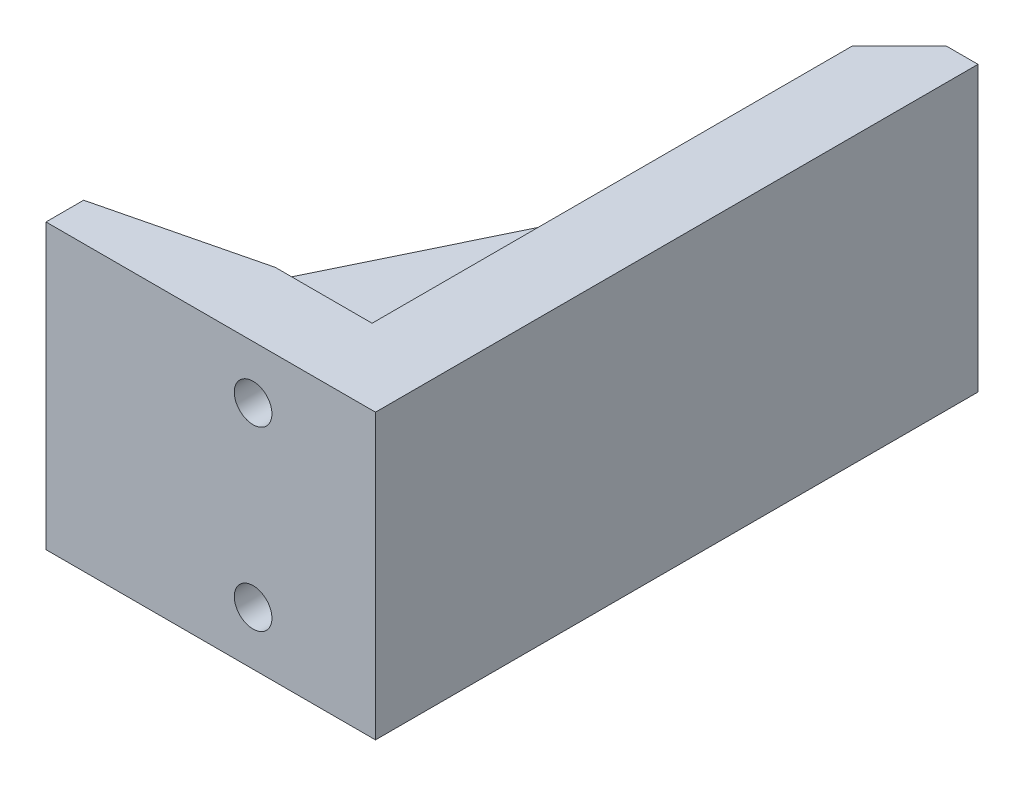
from build123d import *

# Parameters (mm, degrees)
SKETCH1_W           = 17.145
SKETCH1_H           = 17.145
BOSS_EXTRUDE1_DEPTH = 5.08
SKETCH2_R           = 1.27
CUT_EXTRUDE1_DEPTH  = 25.773139688
SKETCH3_R           = 2.54
CUT_EXTRUDE4_DEPTH  = 2.54
SKETCH4_W           = 6.307704678
SKETCH4_H           = 17.145
BOSS_EXTRUDE2_DEPTH = 17.78
SKETCH5_W           = 2.54
SKETCH5_H           = 17.145
BOSS_EXTRUDE3_DEPTH = 5.08
CHAMFER1_SIZE       = 3.175
BOSS_EXTRUDE4_DEPTH = 2.54
BOSS_EXTRUDE5_DEPTH = 2.54
SKETCH9_W           = 1
SKETCH9_H           = 17.145
CUT_EXTRUDE5_DEPTH  = 17.78
EXTRUDE_1_DEPTH     = 1
EXTRUDE_2_DEPTH     = 1
EXTRUDE_3_DEPTH     = 5.31
CUT_EXTRUDE_1_DEPTH = 44.874772364
CUT_EXTRUDE_2_DEPTH = 44.874772364
EXTRUDE_4_DEPTH     = 2.655
EXTRUDE_5_DEPTH     = 6.915
EXTRUDE_6_DEPTH     = 6.92


with BuildPart() as part:
    # Sketch1 → Boss-Extrude1 (new body)
    with BuildSketch(Plane.XY):
        with Locations((8.5725, -8.5725)):
            Rectangle(SKETCH1_W, SKETCH1_H)
    extrude(amount=BOSS_EXTRUDE1_DEPTH)

    # Sketch2 → Cut-Extrude1 (cut, through all)
    with BuildSketch(Plane(origin=(0, 0, 0), x_dir=(-1, 0, 0), z_dir=(0, 0, -1))):
        with Locations((-8.89, -2.5908)):
            Circle(SKETCH2_R)
        with Locations((-8.89, -14.5288)):
            Circle(SKETCH2_R)
    extrude(amount=-CUT_EXTRUDE1_DEPTH, mode=Mode.SUBTRACT)

    # Sketch3 → Cut-Extrude4 (cut)
    with BuildSketch(Plane(origin=(0, 0, 0), x_dir=(-1, 0, 0), z_dir=(0, 0, -1))):
        with Locations((-8.89, -2.5908)):
            Circle(SKETCH3_R)
        with Locations((-8.89, -14.5288)):
            Circle(SKETCH3_R)
    extrude(amount=-CUT_EXTRUDE4_DEPTH, mode=Mode.SUBTRACT)

    # Sketch4 → Boss-Extrude2 (add)
    with BuildSketch(Plane(origin=(0, 0, 0), x_dir=(-1, 0, 0), z_dir=(0, 0, -1))):
        with Locations((-3.153852339, -8.5725)):
            Rectangle(SKETCH4_W, SKETCH4_H)
    extrude(amount=BOSS_EXTRUDE2_DEPTH)

    # Sketch5 → Boss-Extrude3 (add)
    with BuildSketch(Plane.ZY):
        with Locations((3.81, -8.5725)):
            Rectangle(SKETCH5_W, SKETCH5_H)
    extrude(amount=BOSS_EXTRUDE3_DEPTH)

    # Chamfer1
    chamfer1_edges = [part.edges().sort_by_distance(p)[0] for p in [
        (0, -8.5725, -17.78),
    ]]
    chamfer(chamfer1_edges, length=CHAMFER1_SIZE)

    # Sketch7 → Boss-Extrude4 (add)
    with BuildSketch(Plane(origin=(0, 0, 0), x_dir=(1, 0, 0), z_dir=(0, 1, 0))):
        Polygon((-5.08, -2.54), (0, 14.605), (0, -2.54), align=None)
    extrude(amount=-BOSS_EXTRUDE4_DEPTH)

    # Sketch8 → Boss-Extrude5 (add)
    with BuildSketch(Plane.XZ.offset(17.145)):
        Polygon((0, 2.54), (-5.08, 2.54), (0, -14.605), align=None)
    extrude(amount=-BOSS_EXTRUDE5_DEPTH)

    # Sketch9 → Cut-Extrude5 (cut)
    with BuildSketch(Plane(origin=(0, 0, -17.78), x_dir=(-1, 0, 0), z_dir=(0, 0, -1))):
        with Locations((-5.807704678, -8.5725)):
            Rectangle(SKETCH9_W, SKETCH9_H)
    extrude(amount=-CUT_EXTRUDE5_DEPTH, mode=Mode.SUBTRACT)

    # 草图1 → 凸台-拉伸1 (add)
    with BuildSketch(Plane(origin=(0, 0, 0), x_dir=(1, 0, 0), z_dir=(0, 1, 0))):
        Polygon((17.145, 0), (5.307704678, 0), (5.307704678, 17.78), (3.175, 17.78), (0, 14.605), (-5.08, -2.54), (-5.08, -5.08), (17.145, -5.08), align=None)
    extrude(amount=EXTRUDE_1_DEPTH)

    # 草图2 → 凸台-拉伸2 (add)
    with BuildSketch(Plane.XZ.offset(17.145)):
        Polygon((5.307704678, -17.78), (5.307704678, 0), (17.145, 0), (17.145, 5.08), (-5.08, 5.08), (-5.08, 2.54), (0, -14.605), (3.175, -17.78), align=None)
    extrude(amount=EXTRUDE_2_DEPTH)

    # 草图3 → 凸台-拉伸3 (add)
    with BuildSketch(Plane(origin=(17.145, 0, 0), x_dir=(0, 0, -1), z_dir=(1, 0, 0))):
        Polygon((17.78, -18.145), (35.56, -18.145), (35.56, 1), (17.78, 1), (0, 1), (0, -18.145), align=None)
    extrude(amount=-EXTRUDE_3_DEPTH)

    # 草图4 → 切除-拉伸1 (cut, through all)
    with BuildSketch(Plane(origin=(0, 1, 0), x_dir=(1, 0, 0), z_dir=(0, 1, 0))):
        Polygon((15.015, 35.56), (11.835, 32.38), (11.835, 35.56), align=None)
    extrude(amount=-CUT_EXTRUDE_1_DEPTH, mode=Mode.SUBTRACT)

    # 草图5 → 切除-拉伸2 (cut, through all)
    with BuildSketch(Plane(origin=(0, 1, 0), x_dir=(1, 0, 0), z_dir=(0, 1, 0))):
        Polygon((0, 14.605), (-5.08, -2.54), (5.307704678, -2.54), (5.307704678, 0), (5.307704678, 17.78), (3.175, 17.78), align=None)
    extrude(amount=-CUT_EXTRUDE_2_DEPTH, mode=Mode.SUBTRACT)

    # 草图6 → 凸台-拉伸4 (add, symmetric)
    with BuildSketch(Plane(origin=(0, -8.57, 0), x_dir=(-1, 0, 0), z_dir=(0, -1, 0))):
        Polygon((-11.835, 0), (-11.835, 32.38), (5.08, -2.54), (-5.307704678, -2.54), (-5.307704678, 0), align=None)
    extrude(amount=EXTRUDE_4_DEPTH, both=True)

    # 草图7 → 凸台-拉伸5 (add)
    with BuildSketch(Plane(origin=(0, -5.915, 0), x_dir=(1, 0, 0), z_dir=(0, 1, 0))):
        Polygon((5.307704678, -2.54), (-5.08, -2.54), (5.307704678, 0), align=None)
    extrude(amount=EXTRUDE_5_DEPTH)

    # 草图8 → 凸台-拉伸6 (add)
    with BuildSketch(Plane.XZ.offset(11.225)):
        Polygon((-5.08, 2.54), (5.307704678, 2.54), (5.307704678, 0), align=None)
    extrude(amount=EXTRUDE_6_DEPTH)


solid = part.part
